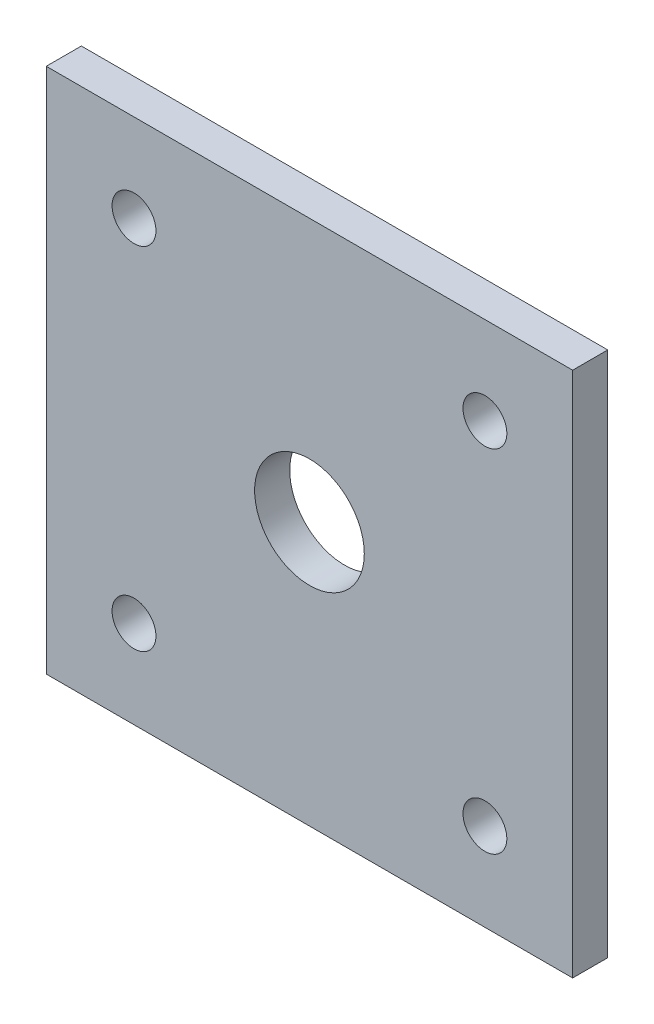
from build123d import *

# Parameters (mm, degrees)
SKETCH2_W            = 120
SKETCH2_H            = 120
BOSS_EXTRUDE1_DEPTH  = 8
SKETCH4_R            = 12.5
CUT_EXTRUDE1_DEPTH   = 86.229103011
SKETCH6_R            = 5
CUT_EXTRUDE2_DEPTH   = 86.229103011
LPATTERN1_COUNT      = 2
LPATTERN1_PITCH      = 80
LPATTERN1_COUNT_DIR2 = 2
LPATTERN1_PITCH_DIR2 = 80


with BuildPart() as part:
    # Sketch2 → Boss-Extrude1 (new body)
    with BuildSketch(Plane.XY):
        Rectangle(SKETCH2_W, SKETCH2_H)
    extrude(amount=BOSS_EXTRUDE1_DEPTH)

    # Sketch4 → Cut-Extrude1 (cut, through all)
    with BuildSketch(Plane.XY.offset(8)):
        Circle(SKETCH4_R)
    extrude(amount=-CUT_EXTRUDE1_DEPTH, mode=Mode.SUBTRACT)

    # Sketch6 → Cut-Extrude2 (cut, through all)
    with BuildSketch(Plane.XY.offset(8)):
        with Locations((-40, 40)):
            Circle(SKETCH6_R)
    cut_extrude2 = extrude(amount=-CUT_EXTRUDE2_DEPTH, mode=Mode.SUBTRACT)

    # LPattern1: Cut-Extrude2 2 × 2
    with Locations(*[(i * LPATTERN1_PITCH, -j * LPATTERN1_PITCH_DIR2, 0) for i in range(LPATTERN1_COUNT) for j in range(LPATTERN1_COUNT_DIR2) if (i, j) != (0, 0)]):
        add(cut_extrude2, mode=Mode.SUBTRACT)


solid = part.part
